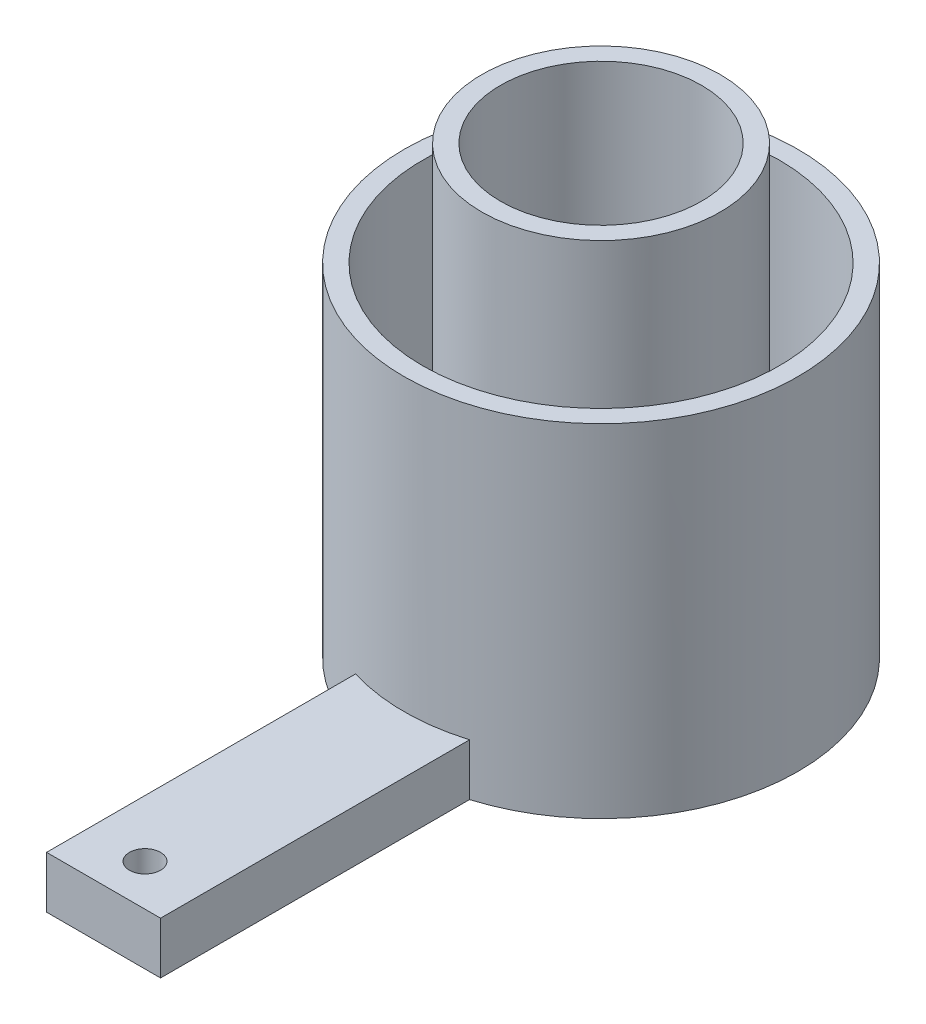
from build123d import *

# Parameters (mm, degrees)
SKETCH1_R           = 19
SKETCH1_R_2         = 17.2
BOSS_EXTRUDE1_DEPTH = 33
SKETCH1_3_R         = 11.5
SKETCH1_3_R_2       = 9.7
BOSS_EXTRUDE2_DEPTH = 43
SKETCH2_R           = 17.2
BOSS_EXTRUDE3_DEPTH = 3
BOSS_EXTRUDE4_DEPTH = 2.4
BOSS_EXTRUDE5_DEPTH = 5
SKETCH5_R           = 1.5
CUT_EXTRUDE1_DEPTH  = 68.186308129


with BuildPart() as part:
    # Sketch1 → Boss-Extrude1 (new body)
    with BuildSketch(Plane(origin=(0, 0, 0), x_dir=(1, 0, 0), z_dir=(0, 1, 0))):
        Circle(SKETCH1_R)
        Circle(SKETCH1_R_2, mode=Mode.SUBTRACT)
    extrude(amount=BOSS_EXTRUDE1_DEPTH)



with BuildPart() as body_2:
    # Sketch1<3> → Boss-Extrude2 (new body)
    with BuildSketch(Plane(origin=(0, 0, 0), x_dir=(1, 0, 0), z_dir=(0, 1, 0))):
        Circle(SKETCH1_3_R)
        Circle(SKETCH1_3_R_2, mode=Mode.SUBTRACT)
    extrude(amount=BOSS_EXTRUDE2_DEPTH)


with BuildPart() as part_1:
    add(part.part)

    add(body_2.part)  # Boss-Extrude3 merges body 2
    # Sketch2 → Boss-Extrude3 (add)
    with BuildSketch(Plane(origin=(0, 10, 0), x_dir=(-1, 0, 0), z_dir=(0, -1, 0))):
        Circle(SKETCH2_R)
    extrude(amount=-BOSS_EXTRUDE3_DEPTH)

    # Sketch3 → Boss-Extrude4 (add)
    with BuildSketch(Plane.XZ):
        with BuildLine():
            Line((-14.921917905, -11.7616481), (-5.15253427, -5.060203124))
            Line((-5.15253427, -5.060203124), (-3.565454801, -6.280270465))
            Line((-3.565454801, -6.280270465), (-7.530041661, -17.444152963))
            ThreePointArc((-7.530041661, -17.444152963), (-11.579954122, -15.063354956), (-14.921917905, -11.7616481))
        make_face()
    extrude(amount=-BOSS_EXTRUDE4_DEPTH)

    # Sketch4 → Boss-Extrude5 (add)
    with BuildSketch(Plane.XZ):
        with BuildLine():
            ThreePointArc((-5.5, 7.989993742), (0, 9.7), (5.5, 7.989993742))
            Line((5.5, 7.989993742), (5.5, 48))
            Line((5.5, 48), (-5.5, 48))
            Line((-5.5, 48), (-5.5, 7.989993742))
        make_face()
    extrude(amount=-BOSS_EXTRUDE5_DEPTH)

    # Sketch5 → Cut-Extrude1 (cut, through all)
    with BuildSketch(Plane.XZ):
        with Locations((0, 44)):
            Circle(SKETCH5_R)
    extrude(amount=-CUT_EXTRUDE1_DEPTH, mode=Mode.SUBTRACT)


solid = part_1.part
